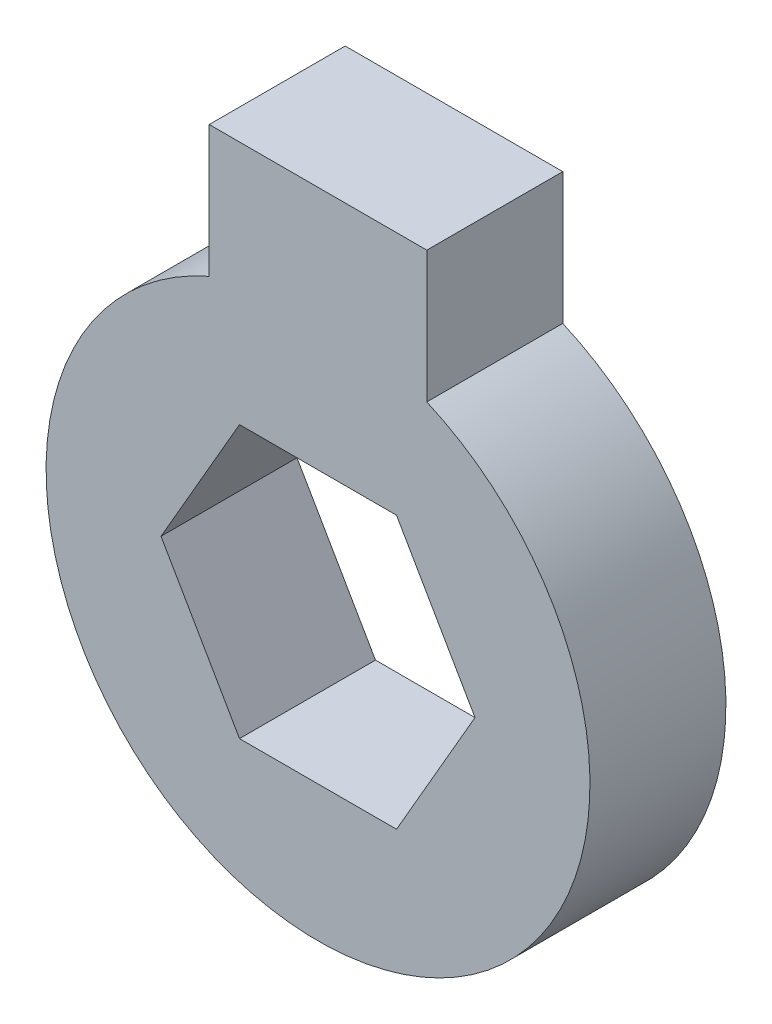
from build123d import *

# Parameters (mm, degrees)
BOSS_EXTRUDE1_DEPTH = 6.35


with BuildPart() as part:
    # Sketch1 → Boss-Extrude1 (new body)
    with BuildSketch(Plane.XY):
        with BuildLine():
            Line((-5.08, 17.78), (5.08, 17.78))
            Line((5.08, 17.78), (5.08, 11.639742265))
            ThreePointArc((5.08, 11.639742265), (0, -12.7), (-5.08, 11.639742265))
            Line((-5.08, 11.639742265), (-5.08, 17.78))
        make_face()
        Polygon((7.332348419, 0), (3.666174209, 6.35), (-3.666174209, 6.35), (-7.332348419, 0), (-3.666174209, -6.35), (3.666174209, -6.35), align=None, mode=Mode.SUBTRACT)
    extrude(amount=BOSS_EXTRUDE1_DEPTH)


solid = part.part
